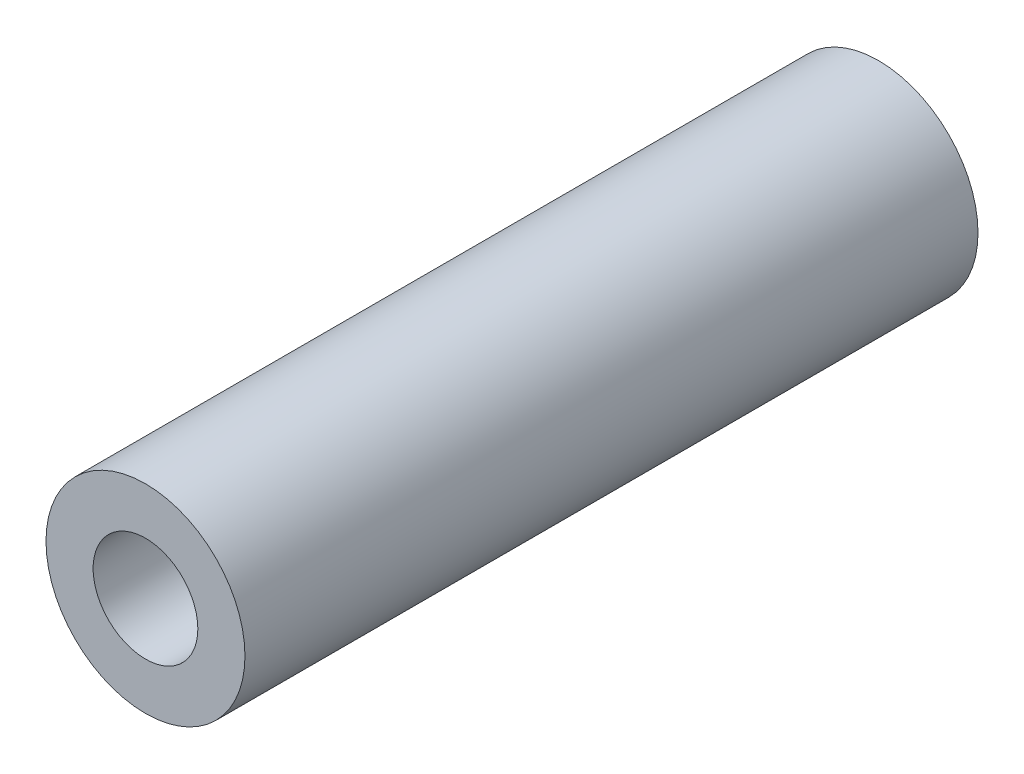
from build123d import *

# Parameters (mm, degrees)
SKETCH1_R           = 4.75
SKETCH1_R_2         = 2.5
BOSS_EXTRUDE1_DEPTH = 17.5


with BuildPart() as part:
    # Sketch1 → Boss-Extrude1 (new, symmetric)
    with BuildSketch(Plane.XY):
        Circle(SKETCH1_R)
        Circle(SKETCH1_R_2, mode=Mode.SUBTRACT)
    extrude(amount=BOSS_EXTRUDE1_DEPTH, both=True)


solid = part.part
